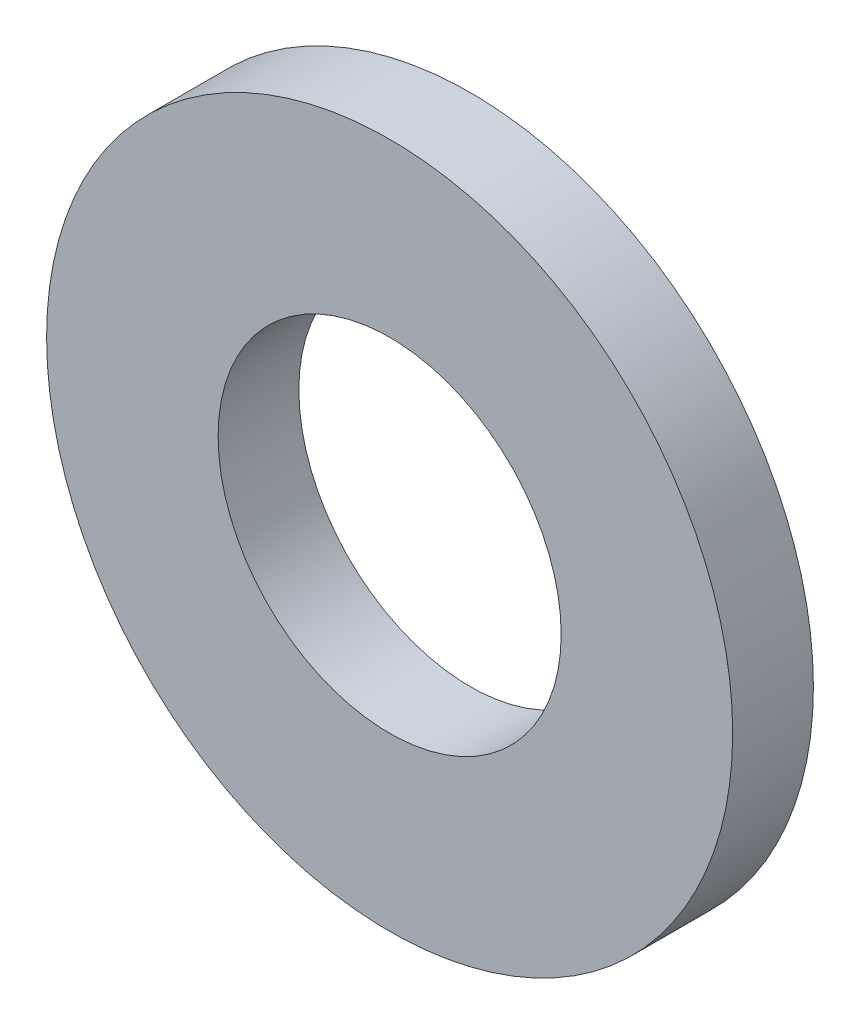
from build123d import *

# Parameters (mm, degrees)
SKETCH1_R           = 8.5
SKETCH1_R_2         = 4.25
BOSS_EXTRUDE1_DEPTH = 2


with BuildPart() as part:
    # Sketch1 → Boss-Extrude1 (new body)
    with BuildSketch(Plane.XY):
        with Locations((0, 260)):
            Circle(SKETCH1_R)
        with Locations((0, 260)):
            Circle(SKETCH1_R_2, mode=Mode.SUBTRACT)
    extrude(amount=BOSS_EXTRUDE1_DEPTH)


solid = part.part
